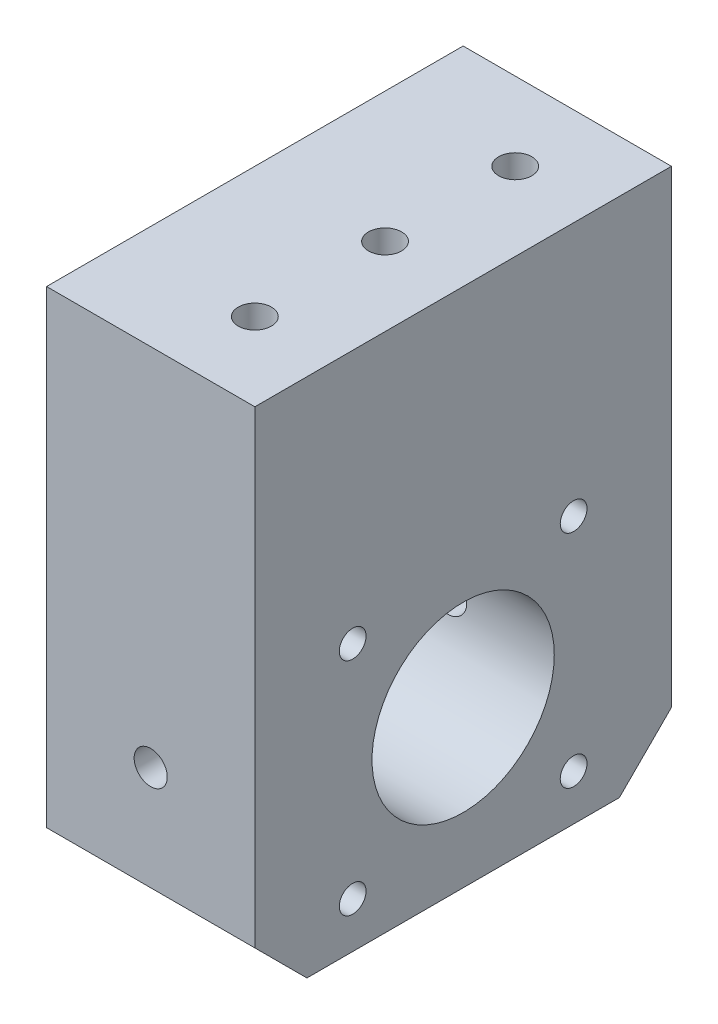
from build123d import *

# Parameters (mm, degrees)
SKETCH1_W                                      = 50.8
SKETCH1_H                                      = 63.5
BASE_DEPTH                                     = 25.4
F_7_8_0_875_DIAMETER_HOLE1_D                   = 22.225
F_10_32_TAPPED_HOLE1_D                         = 4.0386
F_10_32_TAPPED_HOLE1_DEPTH                     = 25.4
F_10_32_TAPPED_HOLE1_TIP                       = 1.213317848
CBORE_FOR_4_SOCKET_HEAD_CAP_SCREW1_D           = 3.2639
CBORE_FOR_4_SOCKET_HEAD_CAP_SCREW1_CBORE_D     = 5.55752
CBORE_FOR_4_SOCKET_HEAD_CAP_SCREW1_CBORE_DEPTH = 2.8448
CIRPATTERN1_COUNT                              = 4
CHAMFER2_SIZE                                  = 6.35
F_10_32_TAPPED_HOLE2_D                         = 4.0386


with BuildPart() as part:
    # Sketch1 → Base (new body)
    with BuildSketch(Plane(origin=(0, 0, 0), x_dir=(0, 0, -1), z_dir=(1, 0, 0))):
        Rectangle(SKETCH1_W, SKETCH1_H)
    extrude(amount=BASE_DEPTH)

    # 7/8 (0.875) Diameter Hole1 (through all)
    with Locations(Plane(origin=(25.4, 0, 0), x_dir=(0, 0, -1), z_dir=(1, 0, 0))):
        with Locations((0, -12.7)):
            Hole(F_7_8_0_875_DIAMETER_HOLE1_D / 2)

    # #10-32 Tapped Hole1
    with Locations(Plane(origin=(0, 31.75, 0), x_dir=(1, 0, 0), z_dir=(0, 1, 0))):
        with Locations((15.875, 15.875), (15.875, -15.875), (15.875, 0)):
            Hole(F_10_32_TAPPED_HOLE1_D / 2, depth=F_10_32_TAPPED_HOLE1_DEPTH)
            with Locations((0, 0, -(F_10_32_TAPPED_HOLE1_DEPTH + F_10_32_TAPPED_HOLE1_TIP / 2))):  # 118° drill point
                Cone(0, F_10_32_TAPPED_HOLE1_D / 2, F_10_32_TAPPED_HOLE1_TIP, mode=Mode.SUBTRACT)

    # CBORE for #4 Socket Head Cap Screw1 (through all)
    with Locations(Plane.ZY):
        with Locations((-13.470384182, 0.770384182)):
            cbore_for_4_socket_head_cap_screw1 = CounterBoreHole(CBORE_FOR_4_SOCKET_HEAD_CAP_SCREW1_D / 2, CBORE_FOR_4_SOCKET_HEAD_CAP_SCREW1_CBORE_D / 2, CBORE_FOR_4_SOCKET_HEAD_CAP_SCREW1_CBORE_DEPTH)

    # CirPattern1: CBORE for #4 Socket Head Cap Screw1 ×4 about axis
    cirpattern1_axis = Axis((0, -12.7, 0), (1, 0, 0))
    for i in range(1, CIRPATTERN1_COUNT):
        add(cbore_for_4_socket_head_cap_screw1.rotate(cirpattern1_axis, i * 360 / CIRPATTERN1_COUNT), mode=Mode.SUBTRACT)

    # Chamfer2
    chamfer2_edges = [part.edges().sort_by_distance(p)[0] for p in [
        (12.7, -31.75, -25.4),
        (12.7, -31.75, 25.4),
    ]]
    chamfer(chamfer2_edges, length=CHAMFER2_SIZE)

    # #10-32 Tapped Hole2 (through all)
    with Locations(Plane(origin=(0, 0, -25.4), x_dir=(-1, 0, 0), z_dir=(0, 0, -1))):
        with Locations((-12.7, -12.7)):
            Hole(F_10_32_TAPPED_HOLE2_D / 2)


solid = part.part
